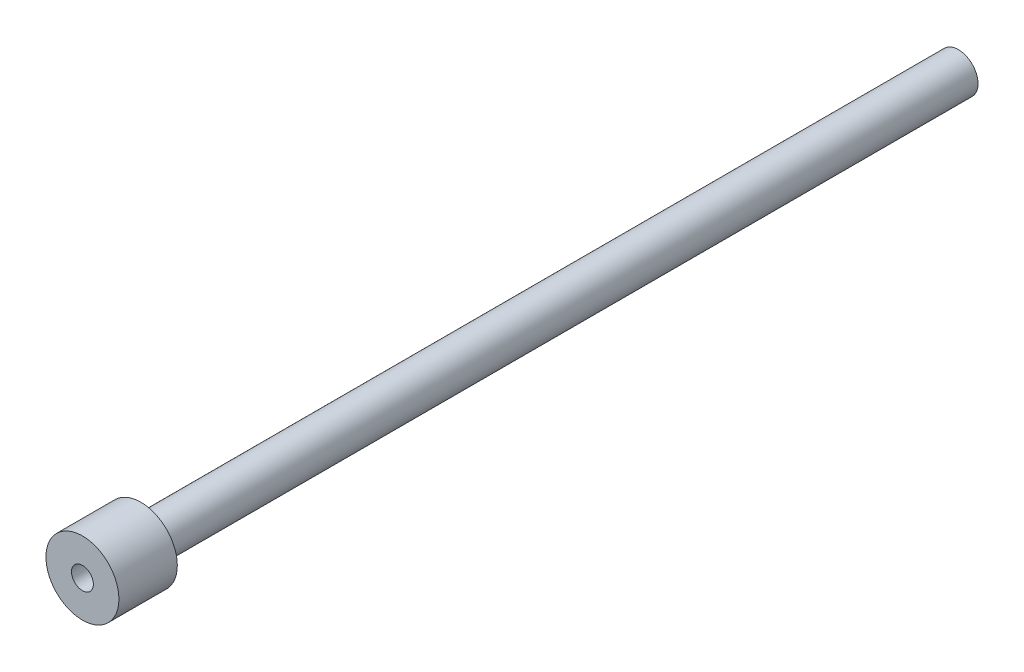
from build123d import *

# Parameters (mm, degrees)
SKETCH1_R           = 12.5
BOSS_EXTRUDE1_DEPTH = 20
SKETCH2_R           = 10.5
SKETCH2_R_2         = 6.75
CUT_EXTRUDE1_DEPTH  = 15
SKETCH3_R           = 3.75
CUT_EXTRUDE2_DEPTH  = 27.69269563
SKETCH4_R           = 6.75
SKETCH4_R_2         = 3.75
BOSS_EXTRUDE2_DEPTH = 280


with BuildPart() as part:
    # Sketch1 → Boss-Extrude1 (new body)
    with BuildSketch(Plane.XY):
        Circle(SKETCH1_R)
    extrude(amount=BOSS_EXTRUDE1_DEPTH)

    # Sketch2 → Cut-Extrude1 (cut)
    with BuildSketch(Plane(origin=(0, 0, 0), x_dir=(-1, 0, 0), z_dir=(0, 0, -1))):
        Circle(SKETCH2_R)
        Circle(SKETCH2_R_2, mode=Mode.SUBTRACT)
    extrude(amount=-CUT_EXTRUDE1_DEPTH, mode=Mode.SUBTRACT)

    # Sketch3 → Cut-Extrude2 (cut, through all)
    with BuildSketch(Plane.XY.offset(20)):
        Circle(SKETCH3_R)
    extrude(amount=-CUT_EXTRUDE2_DEPTH, mode=Mode.SUBTRACT)

    # Sketch4 → Boss-Extrude2 (add)
    with BuildSketch(Plane(origin=(0, 0, 0), x_dir=(-1, 0, 0), z_dir=(0, 0, -1))):
        Circle(SKETCH4_R)
        with Locations(Location((0, 0, 0), (0, 0, 180))):
            Circle(SKETCH4_R_2, mode=Mode.SUBTRACT)
    extrude(amount=BOSS_EXTRUDE2_DEPTH)


solid = part.part
